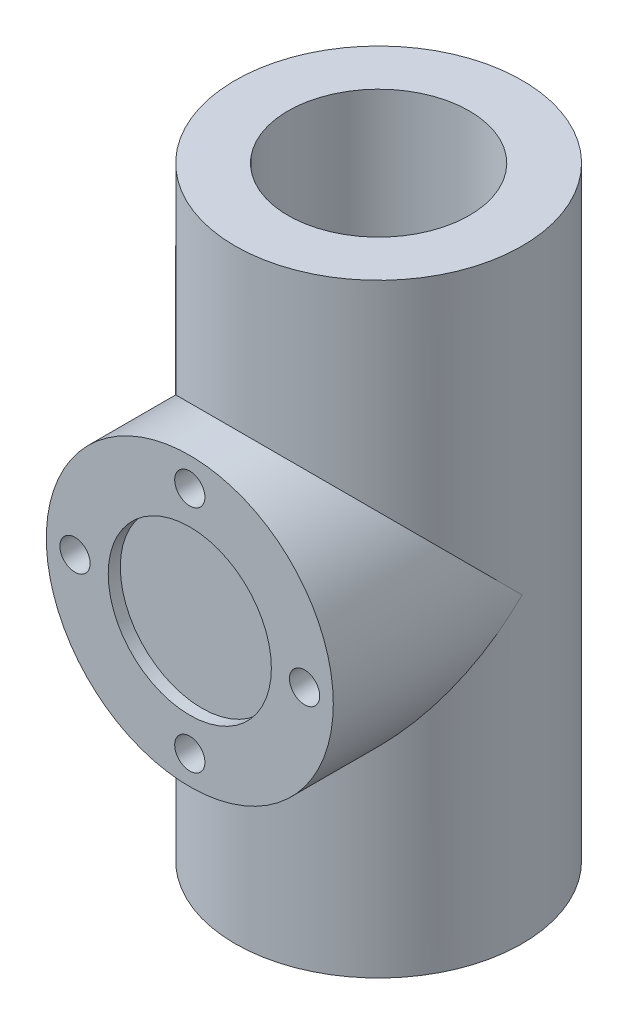
from build123d import *

# Parameters (mm, degrees)
SKETCH1_R                = 47.5
BOSS_EXTRUDE1_DEPTH      = 100
BOSS_EXTRUDE2_REACH      = 158.065
BOSS_EXTRUDE2_END_RADIUS = 47.5
SKETCH2_R                = 47.5
SKETCH3_R                = 30
CUT_EXTRUDE1_DEPTH       = 200
SKETCH4_R                = 27
CUT_EXTRUDE2_DEPTH       = 4
SKETCH5_R                = 5
CUT_EXTRUDE3_DEPTH       = 20


with BuildPart() as part:
    # Sketch1 → Boss-Extrude1 (new, symmetric)
    with BuildSketch(Plane(origin=(0, 0, 0), x_dir=(1, 0, 0), z_dir=(0, 1, 0))):
        with Locations(Location((0, 0, 0), (0, 0, 270))):
            Circle(SKETCH1_R)
    extrude(amount=BOSS_EXTRUDE1_DEPTH, both=True)

    # Boss-Extrude2: up to this cylinder (the profile starts outside it)
    boss_extrude2_end = Plane(origin=(0, 0, 0), z_dir=(0, -1, 0)) * Cylinder(BOSS_EXTRUDE2_END_RADIUS, 412.13, mode=Mode.PRIVATE)
    # Sketch2 → Boss-Extrude2 (add, up to the surface)
    with BuildSketch(Plane.XY.offset(62.5), mode=Mode.PRIVATE) as boss_extrude2_sk1:
        Circle(SKETCH2_R)
    boss_extrude2_tool1 = extrude(boss_extrude2_sk1.sketch, amount=-BOSS_EXTRUDE2_REACH, mode=Mode.PRIVATE) - boss_extrude2_end
    add(boss_extrude2_tool1.solids().sort_by_distance((0, 0, 62.5))[0])

    # Sketch3 → Cut-Extrude1 (cut)
    with BuildSketch(Plane.XZ.offset(100)):
        with Locations(Location((0, 0, 0), (0, 0, 270))):
            Circle(SKETCH3_R)
    extrude(amount=-CUT_EXTRUDE1_DEPTH, mode=Mode.SUBTRACT)

    # Sketch4 → Cut-Extrude2 (cut)
    with BuildSketch(Plane.XY.offset(62.5)):
        Circle(SKETCH4_R)
    extrude(amount=-CUT_EXTRUDE2_DEPTH, mode=Mode.SUBTRACT)

    # Sketch5 → Cut-Extrude3 (cut)
    with BuildSketch(Plane.XY.offset(62.5)):
        with Locations((0, 38)):
            Circle(SKETCH5_R)
        with Locations((38.001, 0.001)):
            Circle(SKETCH5_R)
        with Locations((0.002, -38)):
            Circle(SKETCH5_R)
        with Locations((-37.999, -0.001)):
            Circle(SKETCH5_R)
    extrude(amount=-CUT_EXTRUDE3_DEPTH, mode=Mode.SUBTRACT)


solid = part.part
